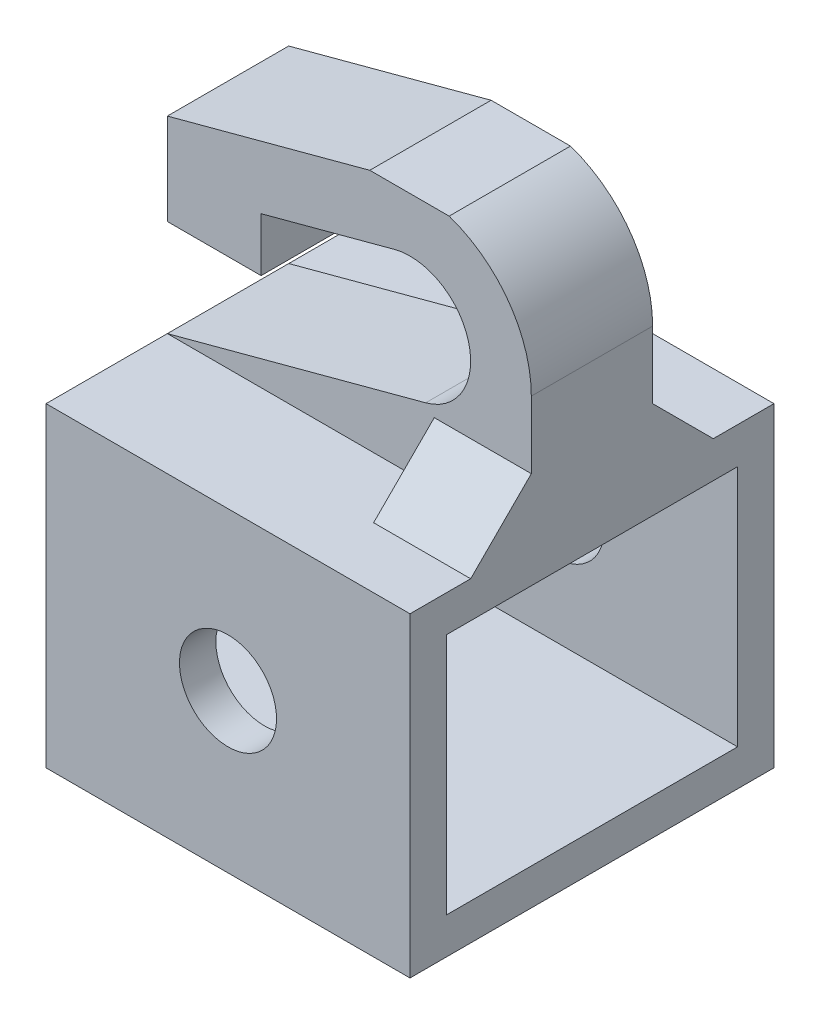
from build123d import *

# Parameters (mm, degrees)
SKETCH1_W           = 30
SKETCH1_H           = 30
BOSS_EXTRUDE1_DEPTH = 26
SHELL1_T            = -3
SKETCH3_R           = 4
CUT_EXTRUDE1_DEPTH  = 43.438190348
BOSS_EXTRUDE4_START = -15
SKETCH4_W           = 10
SKETCH4_H           = 20
BOSS_EXTRUDE4_DEPTH = 30
CUT_EXTRUDE2_DEPTH  = 10
RIB1_REACH          = 58.93
SKETCH7_WALL_W      = 122.930630432
SKETCH7_WALL_H      = 8
CUT_EXTRUDE3_DEPTH  = 10
CUT_EXTRUDE4_DEPTH  = 10
BOSS_EXTRUDE5_REACH = 51.434
SKETCH11_W          = 8
SKETCH11_H          = 10


with BuildPart() as part:
    # Sketch1 → Boss-Extrude1 (new body)
    with BuildSketch(Plane(origin=(0, 0, 0), x_dir=(1, 0, 0), z_dir=(0, 1, 0))):
        Rectangle(SKETCH1_W, SKETCH1_H)
    extrude(amount=BOSS_EXTRUDE1_DEPTH)

    # Shell1
    shell1_openings = [part.faces().sort_by_distance(p)[0] for p in [
        (-15, 13, 0),
        (15, 13, 0),
    ]]
    offset(amount=SHELL1_T, openings=shell1_openings, kind=Kind.INTERSECTION)

    # Sketch3 → Cut-Extrude1 (cut, through all)
    with BuildSketch(Plane.XY.offset(15)):
        with Locations((0, 13)):
            Circle(SKETCH3_R)
    extrude(amount=-CUT_EXTRUDE1_DEPTH, mode=Mode.SUBTRACT)

    # Sketch4 → Boss-Extrude4 (add)
    with BuildSketch(Plane(origin=(0, 0, 0), x_dir=(0, 0, -1), z_dir=(1, 0, 0)).offset(BOSS_EXTRUDE4_START)):
        with Locations((0, 36)):
            Rectangle(SKETCH4_W, SKETCH4_H)
    extrude(amount=BOSS_EXTRUDE4_DEPTH)

    # Sketch6 → Cut-Extrude2 (cut)
    with BuildSketch(Plane(origin=(0, 0, -5), x_dir=(-1, 0, 0), z_dir=(0, 0, -1))):
        with BuildLine():
            Line((15, 26), (15, 36.352761804))
            Line((15, 36.352761804), (-3.705905484, 41.364994072))
            ThreePointArc((-3.705905484, 41.364994072), (-9.829629226, 37.829459621), (-6.294095226, 31.705735619))
            Line((-6.294095226, 31.705735619), (15, 26))
        make_face()
    extrude(amount=-CUT_EXTRUDE2_DEPTH, mode=Mode.SUBTRACT)

    # Sketch7 wall → Rib1 (add, up to next)
    with BuildSketch(Plane(origin=(15, 28.5, -7.5), x_dir=(0, -0.707106781187, -0.707106781187), z_dir=(0, 0.707106781187, -0.707106781187)), mode=Mode.PRIVATE) as rib1_sk1:
        with Locations((0, 4)):
            Rectangle(SKETCH7_WALL_W, SKETCH7_WALL_H)
    rib1_tool1 = extrude(rib1_sk1.sketch, amount=-RIB1_REACH, mode=Mode.PRIVATE) - part.part
    rib1 = rib1_tool1.solids().sort_by_distance((15, 28.5, -7.5))[0]
    add(rib1)

    # Mirror1: Rib1 across plane
    add(rib1.mirror(Plane.XY))

    # Sketch8 → Cut-Extrude3 (cut)
    with BuildSketch(Plane(origin=(0, 0, -5), x_dir=(-1, 0, 0), z_dir=(0, 0, -1))):
        Polygon((15, 41.529142706), (-1.685466574, 46), (15, 46), align=None)
    extrude(amount=-CUT_EXTRUDE3_DEPTH, mode=Mode.SUBTRACT)

    # Sketch9 → Cut-Extrude4 (cut)
    with BuildSketch(Plane(origin=(0, 0, -5), x_dir=(-1, 0, 0), z_dir=(0, 0, -1))):
        with BuildLine():
            Line((-15, 36.535364751), (-15, 46))
            Line((-15, 46), (-8.228107743, 46))
            ThreePointArc((-8.228107743, 46), (-13.132683365, 42.354253071), (-15, 36.535364751))
        make_face()
    extrude(amount=-CUT_EXTRUDE4_DEPTH, mode=Mode.SUBTRACT)

    # Boss-Extrude5: up to this plane
    boss_extrude5_end = Plane(origin=(0, 34, 0), z_dir=(0, 1, 0))
    # Sketch11 → Boss-Extrude5 (add, up to the surface)
    with BuildSketch(Plane(origin=(-10.092999923, 37.667588512, 0), x_dir=(0.965925826289068, 0.25881904510252185, 0), z_dir=(0.25881904510252185, -0.965925826289068, 0)), mode=Mode.PRIVATE) as boss_extrude5_sk1:
        with Locations((-1.080100297, 0)):
            Rectangle(SKETCH11_W, SKETCH11_H)
    boss_extrude5_tool1 = split(extrude(boss_extrude5_sk1.sketch, amount=BOSS_EXTRUDE5_REACH, dir=(0, -1, 0), mode=Mode.PRIVATE), bisect_by=boss_extrude5_end, keep=Keep.BOTH, mode=Mode.PRIVATE)
    add(boss_extrude5_tool1.solids().sort_by_distance((-11.136297, 37.388038, 0))[0])


solid = part.part
